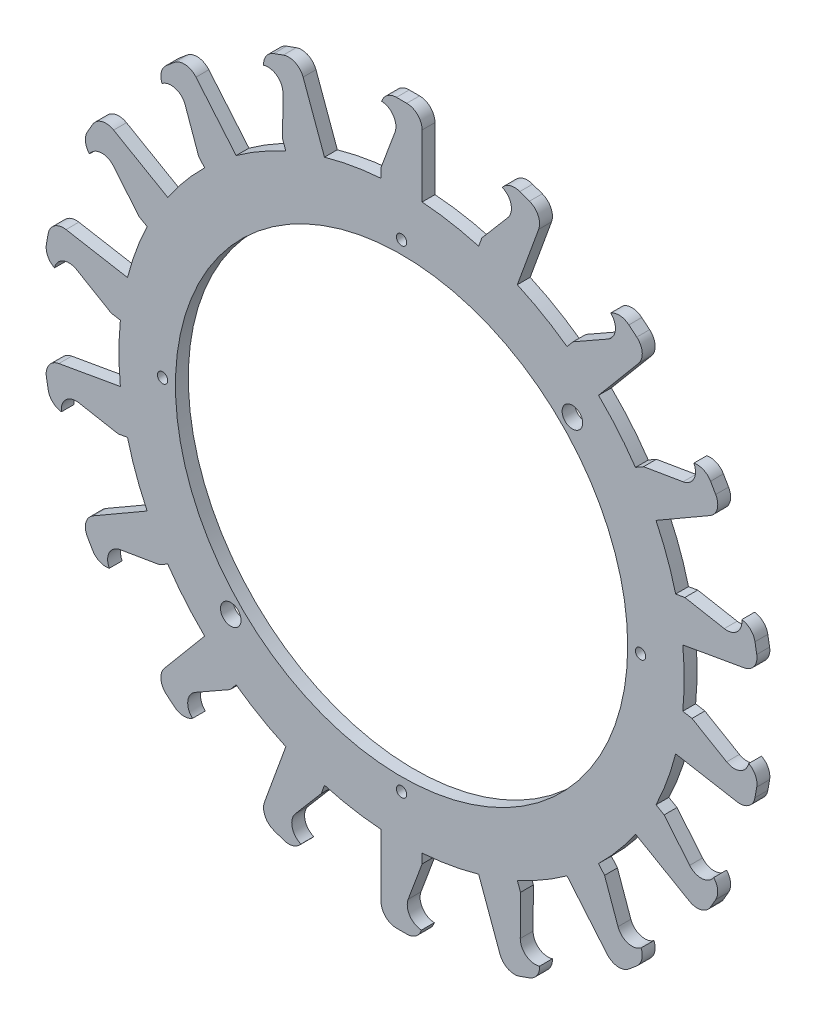
from build123d import *

# Parameters (mm, degrees)
SKETCH1_R           = 69.85
SKETCH1_R_2         = 55.88
BOSS_EXTRUDE1_DEPTH = 3.175
BOSS_EXTRUDE2_DEPTH = 3.175
FILLET4_R           = 3.81
CUT_EXTRUDE1_DEPTH  = 134.459474302
SKETCH4_R           = 1.27
SKETCH4_R_2         = 2.54
CUT_EXTRUDE2_DEPTH  = 134.459474302


with BuildPart() as part:
    # Sketch1 → Boss-Extrude1 (new body)
    with BuildSketch(Plane.XY):
        with Locations((-8.548720341, -3.365444156)):
            Circle(SKETCH1_R)
        with Locations((-8.548720341, -3.365444156)):
            Circle(SKETCH1_R_2, mode=Mode.SUBTRACT)
    extrude(amount=BOSS_EXTRUDE1_DEPTH)

    # Sketch2 → Boss-Extrude2 (add)
    with BuildSketch(Plane(origin=(0, 0, 3.175), x_dir=(-1, 0, 0), z_dir=(0, 0, -1))):
        Polygon((8.548720341, 62.674555844), (13.628720341, 62.674555844), (13.628720341, 85.534555844), (3.468720341, 85.534555844), (3.468720341, 62.674555844), align=None)
        Polygon((34.180672569, 81.91069216), (43.727949596, 78.435767503), (35.90936912, 56.954394192), (31.135730606, 58.69185652), (26.362092093, 60.429318849), align=None)
        Polygon((61.801033071, 68.001267894), (69.584044613, 61.47054578), (54.889919856, 43.95876981), (50.998414085, 47.224130867), (47.106908314, 50.489491924), align=None)
        Polygon((82.998378738, 45.483964895), (88.078378738, 36.685146792), (68.281038007, 25.255146792), (65.741038007, 29.654555844), (63.201038007, 34.053964895), align=None)
        Polygon((95.215996841, 17.074702224), (96.980262327, 7.069055453), (74.467557093, 3.099458112), (73.58542435, 8.102281497), (72.703291608, 13.105104882), align=None)
        Polygon((96.980262327, -13.799943766), (95.215996841, -23.805590536), (72.703291608, -19.835993195), (73.58542435, -14.833169809), (74.467557093, -9.830346424), align=None)
        Polygon((88.078378738, -43.416035105), (82.998378738, -52.214853208), (63.201038007, -40.784853208), (65.741038007, -36.385444156), (68.281038007, -31.986035105), align=None)
        Polygon((69.584044613, -68.201434092), (61.801033071, -74.732156207), (47.106908314, -57.220380237), (50.998414085, -53.95501918), (54.889919856, -50.689658123), align=None)
        Polygon((43.727949596, -85.166655816), (34.180672569, -88.641580472), (26.362092093, -67.160207161), (31.135730606, -65.422744833), (35.90936912, -63.685282505), align=None)
        Polygon((13.628720341, -92.265444156), (3.468720341, -92.265444156), (3.468720341, -69.405444156), (8.548720341, -69.405444156), (13.628720341, -69.405444156), align=None)
        Polygon((-17.083231887, -88.641580472), (-26.630508914, -85.166655816), (-18.811928438, -63.685282505), (-14.038289924, -65.422744833), (-9.26465141, -67.160207161), align=None)
        Polygon((-44.703592389, -74.732156207), (-52.486603931, -68.201434092), (-37.792479174, -50.689658123), (-33.900973402, -53.95501918), (-30.009467631, -57.220380237), align=None)
        Polygon((-65.900938055, -52.214853208), (-70.980938055, -43.416035105), (-51.183597325, -31.986035105), (-48.643597325, -36.385444156), (-46.103597325, -40.784853208), align=None)
        Polygon((-78.118556159, -23.805590536), (-79.882821644, -13.799943766), (-57.37011641, -9.830346424), (-56.487983668, -14.833169809), (-55.605850925, -19.835993195), align=None)
        Polygon((-79.882821644, 7.069055453), (-78.118556159, 17.074702224), (-55.605850925, 13.105104882), (-56.487983668, 8.102281497), (-57.37011641, 3.099458112), align=None)
        Polygon((-70.980938055, 36.685146792), (-65.900938055, 45.483964895), (-46.103597325, 34.053964895), (-48.643597325, 29.654555844), (-51.183597325, 25.255146792), align=None)
        Polygon((-52.486603931, 61.47054578), (-44.703592389, 68.001267894), (-30.009467631, 50.489491924), (-33.900973402, 47.224130867), (-37.792479174, 43.95876981), align=None)
        Polygon((-26.630508914, 78.435767503), (-17.083231887, 81.91069216), (-9.26465141, 60.429318849), (-14.038289924, 58.69185652), (-18.811928438, 56.954394192), align=None)
    extrude(amount=BOSS_EXTRUDE2_DEPTH)

    # Fillet4
    fillet4_edges = [part.edges().sort_by_distance(p)[0] for p in [
        (-82.998378738, 45.483964895, 1.5875),
        (-88.078378738, 36.685146792, 1.5875),
        (-95.215996841, 17.074702224, 1.5875),
        (-96.980262327, 7.069055453, 1.5875),
        (-96.980262327, -13.799943766, 1.5875),
        (-95.215996841, -23.805590536, 1.5875),
        (-88.078378738, -43.416035105, 1.5875),
        (-82.998378738, -52.214853208, 1.5875),
        (-69.584044613, -68.201434092, 1.5875),
        (-61.801033071, -74.732156207, 1.5875),
        (-43.727949596, -85.166655816, 1.5875),
        (-34.180672569, -88.641580472, 1.5875),
        (-13.628720341, -92.265444156, 1.5875),
        (-3.468720341, -92.265444156, 1.5875),
        (17.083231887, -88.641580472, 1.5875),
        (26.630508914, -85.166655816, 1.5875),
        (-3.468720341, 85.534555844, 1.5875),
        (-13.628720341, 85.534555844, 1.5875),
        (44.703592389, -74.732156207, 1.5875),
        (52.486603931, -68.201434092, 1.5875),
        (65.900938055, -52.214853208, 1.5875),
        (70.980938055, -43.416035105, 1.5875),
        (78.118556159, -23.805590536, 1.5875),
        (79.882821644, -13.799943766, 1.5875),
        (79.882821644, 7.069055453, 1.5875),
        (78.118556159, 17.074702224, 1.5875),
        (70.980938055, 36.685146792, 1.5875),
        (65.900938055, 45.483964895, 1.5875),
        (52.486603931, 61.47054578, 1.5875),
        (44.703592389, 68.001267894, 1.5875),
        (26.630508914, 78.435767503, 1.5875),
        (17.083231887, 81.91069216, 1.5875),
        (-34.180672569, 81.91069216, 1.5875),
        (-43.727949596, 78.435767503, 1.5875),
        (-61.801033071, 68.001267894, 1.5875),
        (-69.584044613, 61.47054578, 1.5875),
    ]]
    fillet(fillet4_edges, radius=FILLET4_R)

    # Sketch3 → Cut-Extrude1 (cut, through all)
    with BuildSketch(Plane(origin=(0, 0, 0), x_dir=(-1, 0, 0), z_dir=(0, 0, -1))):
        with BuildLine():
            Line((13.628720341, 68.616049563), (10.176595979, 77.901073709))
            ThreePointArc((10.176595979, 77.901073709), (12.345238207, 82.636680206), (17.080844703, 80.468037978))
            Line((17.080844703, 80.468037978), (20.532969065, 71.183013832))
            ThreePointArc((20.532969065, 71.183013832), (18.364326838, 66.447407336), (13.628720341, 68.616049563))
        make_face()
        with BuildLine():
            Line((37.941479654, 62.537571997), (37.873209154, 72.44333674))
            ThreePointArc((37.873209154, 72.44333674), (41.530739065, 76.151631894), (45.239034219, 72.494101983))
            Line((45.239034219, 72.494101983), (45.307304719, 62.58833724))
            ThreePointArc((45.307304719, 62.58833724), (41.649774808, 58.880042086), (37.941479654, 62.537571997))
        make_face()
        with BuildLine():
            Line((58.709038402, 48.510218058), (62.032856194, 57.841941976))
            ThreePointArc((62.032856194, 57.841941976), (66.738121702, 60.075650664), (68.97183039, 55.370385156))
            Line((68.97183039, 55.370385156), (65.648012597, 46.038661238))
            ThreePointArc((65.648012597, 46.038661238), (60.94274709, 43.80495255), (58.709038402, 48.510218058))
        make_face()
        with BuildLine():
            Line((73.426522505, 28.225893652), (79.741527109, 35.85803312))
            ThreePointArc((79.741527109, 35.85803312), (84.927003751, 36.347737107), (85.416707738, 31.162260465))
            Line((85.416707738, 31.162260465), (79.101703134, 23.530120998))
            ThreePointArc((79.101703134, 23.530120998), (73.916226492, 23.04041701), (73.426522505, 28.225893652))
        make_face()
        with BuildLine():
            Line((80.318786172, 4.131187669), (88.863294833, 9.143194027))
            ThreePointArc((88.863294833, 9.143194027), (93.903537597, 7.829827786), (92.590171356, 2.789585023))
            Line((92.590171356, 2.789585023), (84.045662695, -2.222421336))
            ThreePointArc((84.045662695, -2.222421336), (79.005419931, -0.909055095), (80.318786172, 4.131187669))
        make_face()
        with BuildLine():
            Line((78.554520687, -20.867722752), (88.297939557, -19.080371438))
            ThreePointArc((88.297939557, -19.080371438), (92.58502078, -22.038396556), (89.626995662, -26.325477778))
            Line((89.626995662, -26.325477778), (79.883576792, -28.112829091))
            ThreePointArc((79.883576792, -28.112829091), (75.59649557, -25.154803974), (78.554520687, -20.867722752))
        make_face()
        with BuildLine():
            Line((68.346522505, -43.755600067), (78.113651471, -45.408484746))
            ThreePointArc((78.113651471, -45.408484746), (81.130485885, -49.654387255), (76.884583377, -52.671221669))
            Line((76.884583377, -52.671221669), (67.11745441, -51.018336991))
            ThreePointArc((67.11745441, -51.018336991), (64.100619996, -46.772434482), (68.346522505, -43.755600067))
        make_face()
        with BuildLine():
            Line((50.92602686, -61.771828485), (59.538806021, -66.665586869))
            ThreePointArc((59.538806021, -66.665586869), (60.921518874, -71.687248264), (55.899857479, -73.069961117))
            Line((55.899857479, -73.069961117), (47.287078318, -68.176202733))
            ThreePointArc((47.287078318, -68.176202733), (45.904365465, -63.154541338), (50.92602686, -61.771828485))
        make_face()
        with BuildLine():
            Line((28.394202626, -72.743384966), (34.813803704, -80.28775757))
            ThreePointArc((34.813803704, -80.28775757), (34.395619419, -85.479491376), (29.203885614, -85.06130709))
            Line((29.203885614, -85.06130709), (22.784284536, -77.516934485))
            ThreePointArc((22.784284536, -77.516934485), (23.202468821, -72.32520068), (28.394202626, -72.743384966))
        make_face()
        with BuildLine():
            Line((3.468720341, -75.346937876), (6.920844703, -84.631962022))
            ThreePointArc((6.920844703, -84.631962022), (4.752202476, -89.367568518), (0.016595979, -87.198926291))
            Line((0.016595979, -87.198926291), (-3.435528383, -77.913902145))
            ThreePointArc((-3.435528383, -77.913902145), (-1.266886155, -73.178295648), (3.468720341, -75.346937876))
        make_face()
        with BuildLine():
            Line((-20.844038971, -69.26846031), (-20.775768471, -79.174225052))
            ThreePointArc((-20.775768471, -79.174225052), (-24.433298382, -82.882520207), (-28.141593536, -79.224990296))
            Line((-28.141593536, -79.224990296), (-28.209864036, -69.319225553))
            ThreePointArc((-28.209864036, -69.319225553), (-24.552334125, -65.610930399), (-20.844038971, -69.26846031))
        make_face()
        with BuildLine():
            Line((-41.611597719, -55.24110637), (-44.935415512, -64.572830288))
            ThreePointArc((-44.935415512, -64.572830288), (-49.640681019, -66.806538976), (-51.874389707, -62.101273469))
            Line((-51.874389707, -62.101273469), (-48.550571915, -52.76954955))
            ThreePointArc((-48.550571915, -52.76954955), (-43.845306407, -50.535840863), (-41.611597719, -55.24110637))
        make_face()
        with BuildLine():
            Line((-56.329081822, -34.956781965), (-62.644086426, -42.588921432))
            ThreePointArc((-62.644086426, -42.588921432), (-67.829563068, -43.07862542), (-68.319267056, -37.893148778))
            Line((-68.319267056, -37.893148778), (-62.004262452, -30.26100931))
            ThreePointArc((-62.004262452, -30.26100931), (-56.81878581, -29.771305323), (-56.329081822, -34.956781965))
        make_face()
        with BuildLine():
            Line((-63.22134549, -10.862075981), (-71.765854151, -15.87408234))
            ThreePointArc((-71.765854151, -15.87408234), (-76.806096915, -14.560716099), (-75.492730674, -9.520473335))
            Line((-75.492730674, -9.520473335), (-66.948222013, -4.508466977))
            ThreePointArc((-66.948222013, -4.508466977), (-61.907979249, -5.821833217), (-63.22134549, -10.862075981))
        make_face()
        with BuildLine():
            Line((-61.457080005, 14.136834439), (-71.200498875, 12.349483126))
            ThreePointArc((-71.200498875, 12.349483126), (-75.487580097, 15.307508243), (-72.52955498, 19.594589465))
            Line((-72.52955498, 19.594589465), (-62.78613611, 21.381940779))
            ThreePointArc((-62.78613611, 21.381940779), (-58.499054887, 18.423915661), (-61.457080005, 14.136834439))
        make_face()
        with BuildLine():
            Line((-51.249081822, 37.024711755), (-61.016210788, 38.677596433))
            ThreePointArc((-61.016210788, 38.677596433), (-64.033045203, 42.923498942), (-59.787142694, 45.940333357))
            Line((-59.787142694, 45.940333357), (-50.020013728, 44.287448678))
            ThreePointArc((-50.020013728, 44.287448678), (-47.003179313, 40.041546169), (-51.249081822, 37.024711755))
        make_face()
        with BuildLine():
            Line((-33.828586177, 55.040940172), (-42.441365338, 59.934698556))
            ThreePointArc((-42.441365338, 59.934698556), (-43.824078191, 64.956359951), (-38.802416796, 66.339072804))
            Line((-38.802416796, 66.339072804), (-30.189637635, 61.44531442))
            ThreePointArc((-30.189637635, 61.44531442), (-28.806924782, 56.423653025), (-33.828586177, 55.040940172))
        make_face()
        with BuildLine():
            Line((-11.296761944, 66.012496653), (-17.716363022, 73.556869258))
            ThreePointArc((-17.716363022, 73.556869258), (-17.298178737, 78.748603063), (-12.106444931, 78.330418777))
            Line((-12.106444931, 78.330418777), (-5.686843853, 70.786046173))
            ThreePointArc((-5.686843853, 70.786046173), (-6.105028139, 65.594312368), (-11.296761944, 66.012496653))
        make_face()
    extrude(amount=-CUT_EXTRUDE1_DEPTH, mode=Mode.SUBTRACT)

    # Sketch4 → Cut-Extrude2 (cut, through all)
    with BuildSketch(Plane(origin=(0, 0, 0), x_dir=(-1, 0, 0), z_dir=(0, 0, -1))):
        with Locations((8.548720341, 55.689555844)):
            Circle(SKETCH4_R)
        with Locations((8.548720341, -62.420444156)):
            Circle(SKETCH4_R)
        with Locations((-50.506279659, -3.365444156)):
            Circle(SKETCH4_R)
        with Locations((67.603720341, -3.365444156)):
            Circle(SKETCH4_R)
        with Locations((-33.658483428, 38.841759613)):
            Circle(SKETCH4_R_2)
        with Locations((50.75592411, -45.572647925)):
            Circle(SKETCH4_R_2)
    extrude(amount=-CUT_EXTRUDE2_DEPTH, mode=Mode.SUBTRACT)


solid = part.part
